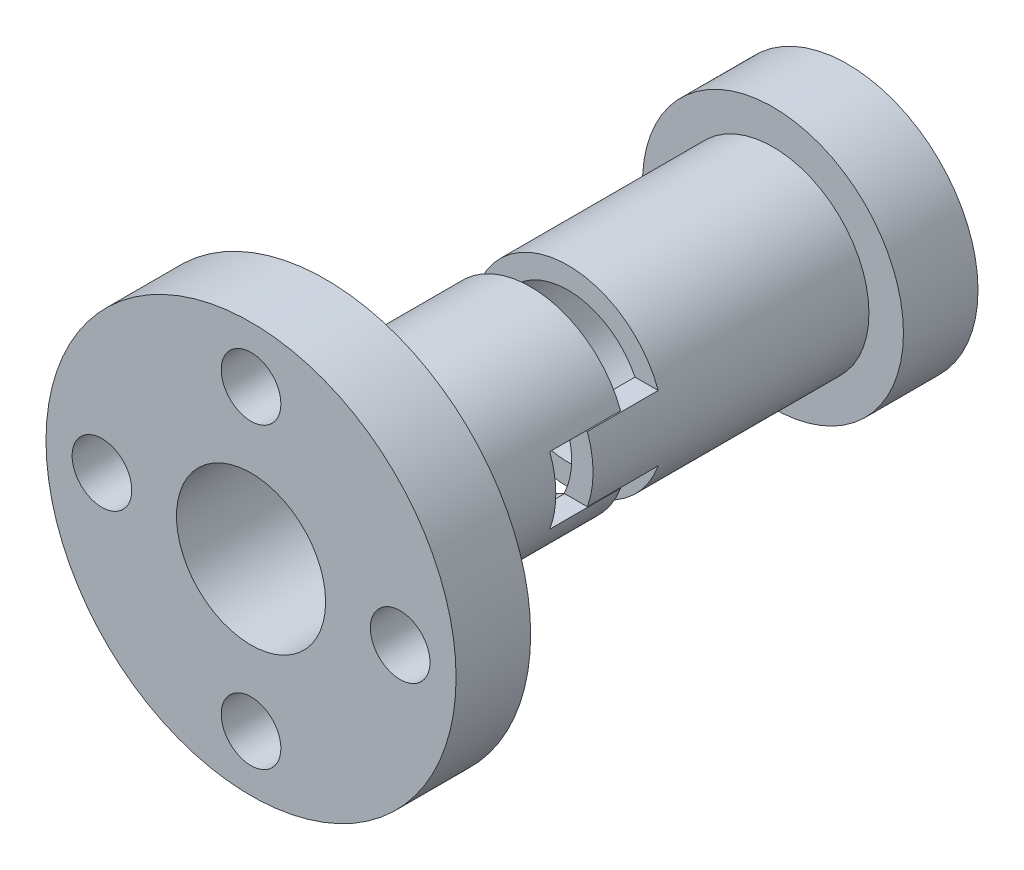
from build123d import *

# Parameters (mm, degrees)
MATRIZC1_COUNT             = 4
CORTAR_EXTRUIR1_DEPTH      = 36.580893749
CORTAR_EXTRUIR1_DEPTH_BACK = 36.580893749


with BuildPart() as part:
    # Croquis1 → Revolución1 (revolve)
    with BuildSketch(Plane(origin=(0, 0, 0), x_dir=(0, 0, -1), z_dir=(1, 0, 0)), mode=Mode.PRIVATE) as revoluci_n1_sk:
        Polygon((0, 4), (0, 11), (4, 11), (4, 5.15), (28, 5.15), (28, 7), (32, 7), (32, 4), align=None)
    revolve(revoluci_n1_sk.sketch.rotate(Axis((0, 0, 0), (0, 0, -1)), 90), axis=Axis((0, 0, 0), (0, 0, -1)))

    # Croquis3 → Taladro de margen para M31 (revolve, cut)
    with BuildSketch(Plane(origin=(8, 0, 0), x_dir=(0, -1, 0), z_dir=(1, 0, 0))):
        Polygon((0, 0), (0, 8.6), (1.6, 7), (1.6, 0), align=None)
    taladro_de_margen_para_m31 = revolve(axis=Axis((8, 0, 6.35), (0, 0, -1)), mode=Mode.SUBTRACT)

    # MatrizC1: Taladro de margen para M31 ×4 about axis
    matrizc1_axis = Axis((0, 0, 0), (0, 0, 1))
    for i in range(1, MATRIZC1_COUNT):
        add(taladro_de_margen_para_m31.rotate(matrizc1_axis, i * 360 / MATRIZC1_COUNT), mode=Mode.SUBTRACT)

    # Croquis4 → Cortar-Extruir1 (cut, two sides: drawn at the far end of the back side and taken through both)
    with BuildSketch(Plane(origin=(0, 0, 0), x_dir=(0, 0, -1), z_dir=(1, 0, 0)).offset(-CORTAR_EXTRUIR1_DEPTH_BACK)):
        Polygon((11.2, -1.8), (15, -1.8), (15, -5.15), (17, -5.15), (17, -1.75), (13.2, -1.75), (13.2, 1.75), (17, 1.75), (17, 5.15), (15, 5.15), (15, 1.8), (11.2, 1.8), align=None)
    extrude(amount=CORTAR_EXTRUIR1_DEPTH + CORTAR_EXTRUIR1_DEPTH_BACK, mode=Mode.SUBTRACT)


with BuildPart() as cortar_extruir1_piece_1:
    # of the separate pieces the step leaves, piece 1, a body of its own (cortar_extruir1_pieces)
    add(part.part.solids().sort_by_distance((11, 0, 0))[0])


with BuildPart() as cortar_extruir1_piece_2:
    # of the separate pieces the step leaves, piece 2, a body of its own (cortar_extruir1_pieces)
    add(part.part.solids().sort_by_distance((4, 0, -32))[0])


solid = Compound([cortar_extruir1_piece_1.part, cortar_extruir1_piece_2.part])
